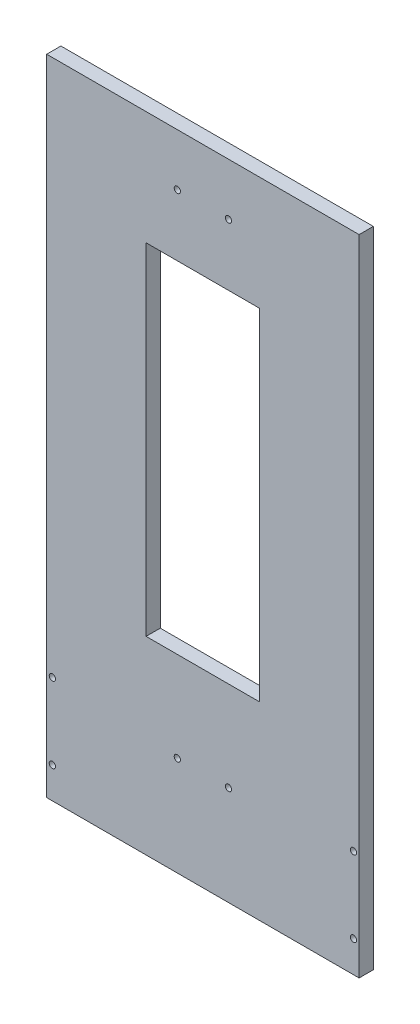
from build123d import *

# Parameters (mm, degrees)
SKETCH1_W               = 330
SKETCH1_H               = 680
BOSS_EXTRUDE1_DEPTH     = 15
CUT_EXTRUDE1_DEPTH      = 700.892848942
CUT_EXTRUDE1_DEPTH_BACK = 700.892848942
SKETCH2_R               = 3.3
SKETCH3_R               = 5.5
CUT_EXTRUDE3_DEPTH      = 6.5
CUT_EXTRUDE4_DEPTH      = 700.892848942
CUT_EXTRUDE4_DEPTH_BACK = 700.892848942
SKETCH4_R               = 3.3
SKETCH5_R               = 5.5
CUT_EXTRUDE6_DEPTH      = 6.5
SKETCH6_R               = 2.5
CUT_EXTRUDE8_DEPTH      = 15
CUT_EXTRUDE9_DEPTH      = 700.892848942
CUT_EXTRUDE9_DEPTH_BACK = 700.892848942
SKETCH7_W               = 120
SKETCH7_H               = 360


with BuildPart() as part:
    # Sketch1 → Boss-Extrude1 (new body)
    with BuildSketch(Plane.XY):
        with Locations((0, 340)):
            Rectangle(SKETCH1_W, SKETCH1_H)
    extrude(amount=BOSS_EXTRUDE1_DEPTH)

    # Sketch2 → Cut-Extrude1 (cut, two sides: drawn at the far end of the back side and taken through both)
    with BuildSketch(Plane.XY.offset(-CUT_EXTRUDE1_DEPTH_BACK)):
        with Locations((-27, 105)):
            Circle(SKETCH2_R)
        with Locations((-27, 625)):
            Circle(SKETCH2_R)
        with Locations((27, 105)):
            Circle(SKETCH2_R)
        with Locations((27, 625)):
            Circle(SKETCH2_R)
    extrude(amount=CUT_EXTRUDE1_DEPTH + CUT_EXTRUDE1_DEPTH_BACK, mode=Mode.SUBTRACT)

    # Sketch3 → Cut-Extrude3 (cut)
    with BuildSketch(Plane.XY):
        with Locations((-27, 105)):
            Circle(SKETCH3_R)
        with Locations((-27, 625)):
            Circle(SKETCH3_R)
        with Locations((27, 105)):
            Circle(SKETCH3_R)
        with Locations((27, 625)):
            Circle(SKETCH3_R)
    extrude(amount=CUT_EXTRUDE3_DEPTH, mode=Mode.SUBTRACT)

    # Sketch4 → Cut-Extrude4 (cut, two sides: drawn at the far end of the back side and taken through both)
    with BuildSketch(Plane.XY.offset(-CUT_EXTRUDE4_DEPTH_BACK)):
        with Locations((-159, 33)):
            Circle(SKETCH4_R)
        with Locations((-159, 113)):
            Circle(SKETCH4_R)
        with Locations((159, 33)):
            Circle(SKETCH4_R)
        with Locations((159, 113)):
            Circle(SKETCH4_R)
    extrude(amount=CUT_EXTRUDE4_DEPTH + CUT_EXTRUDE4_DEPTH_BACK, mode=Mode.SUBTRACT)

    # Sketch5 → Cut-Extrude6 (cut)
    with BuildSketch(Plane.XY):
        with Locations((-159, 33)):
            Circle(SKETCH5_R)
        with Locations((-159, 113)):
            Circle(SKETCH5_R)
        with Locations((159, 33)):
            Circle(SKETCH5_R)
        with Locations((159, 113)):
            Circle(SKETCH5_R)
    extrude(amount=CUT_EXTRUDE6_DEPTH, mode=Mode.SUBTRACT)

    # Sketch6 → Cut-Extrude8 (cut)
    with BuildSketch(Plane(origin=(0, 0, 0), x_dir=(1, 0, 0), z_dir=(0, 1, 0))):
        with Locations(Location((-120, -7.5, 0), (0, 0, 270))):
            Circle(SKETCH6_R)
        with Locations(Location((-60, -7.5, 0), (0, 0, 270))):
            Circle(SKETCH6_R)
        with Locations(Location((60, -7.5, 0), (0, 0, 270))):
            Circle(SKETCH6_R)
        with Locations(Location((120, -7.5, 0), (0, 0, 270))):
            Circle(SKETCH6_R)
    extrude(amount=CUT_EXTRUDE8_DEPTH, mode=Mode.SUBTRACT)

    # Sketch7 → Cut-Extrude9 (cut, two sides: drawn at the far end of the back side and taken through both)
    with BuildSketch(Plane.XY.offset(-CUT_EXTRUDE9_DEPTH_BACK)):
        with Locations((0, 380)):
            Rectangle(SKETCH7_W, SKETCH7_H)
    extrude(amount=CUT_EXTRUDE9_DEPTH + CUT_EXTRUDE9_DEPTH_BACK, mode=Mode.SUBTRACT)


solid = part.part
